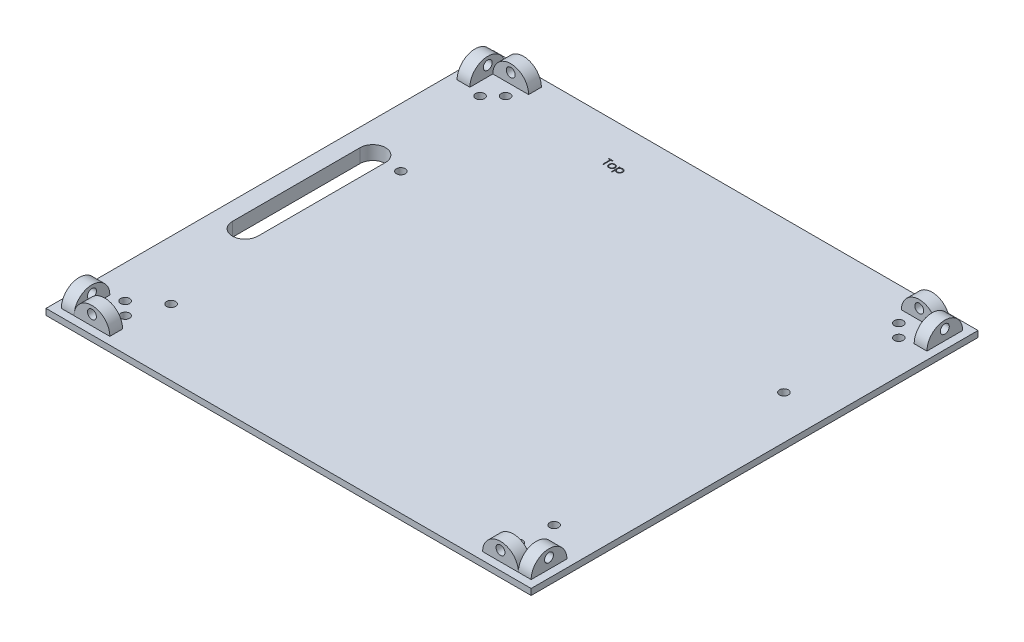
from build123d import *

# Parameters (mm, degrees)
SKETCH1_W                   = 190
SKETCH1_H                   = 175
SKETCH1_R                   = 1.75
BASE_DEPTH                  = 5.4
SKETCH3_R                   = 1.75
LONG_SIDE_CONNECTORS_DEPTH  = 5
SHORT_SIDE_CONNECTORS_DEPTH = 5
MIRROR3_COPY_1_DEPTH        = 5
CUT_EXTRUDE6_START          = -5.4
SKETCH11_R                  = 1.75
CUT_EXTRUDE6_DEPTH          = 179.761105811
CHAMFER2_SIZE               = 3
CUT_EXTRUDE7_DEPTH          = 1
CUT_EXTRUDE8_DEPTH          = 174.361105949


with BuildPart() as part:
    # Sketch1 → Base (new body)
    with BuildSketch(Plane(origin=(0, 0, 0), x_dir=(1, 0, 0), z_dir=(0, 1, 0))):
        with Locations((-51.064381671, 5.614281477)):
            Rectangle(SKETCH1_W, SKETCH1_H)
        with Locations(Location((-123.064381671, 34.114281477, 0), (0, 0, 270))):
            Circle(SKETCH1_R, mode=Mode.SUBTRACT)
        with Locations(Location((26.935618329, 34.114281477, 0), (0, 0, 270))):
            Circle(SKETCH1_R, mode=Mode.SUBTRACT)
        with Locations(Location((26.935618329, -55.885718523, 0), (0, 0, 270))):
            Circle(SKETCH1_R, mode=Mode.SUBTRACT)
        with Locations(Location((-123.064381671, -55.885718523, 0), (0, 0, 270))):
            Circle(SKETCH1_R, mode=Mode.SUBTRACT)
    extrude(amount=-BASE_DEPTH)

    # Sketch3 → Long_Side_connectors (add)
    # profile 1 of 2: a face of its own
    with BuildSketch(Plane(origin=(-143.064381671, 0, 0), x_dir=(0, 0, -1), z_dir=(1, 0, 0))):
        with BuildLine():
            Line((76.114281477, 0), (90.114281477, 0))
            ThreePointArc((90.114281477, 0), (83.114281477, 7), (76.114281477, 0))
        make_face()
        with Locations((83.114281477, 4)):
            Circle(SKETCH3_R, mode=Mode.SUBTRACT)
    # profile 2 of 2: a face of its own
    with BuildSketch(Plane(origin=(-143.064381671, 0, 0), x_dir=(0, 0, -1), z_dir=(1, 0, 0))):
        with BuildLine():
            Line((-78.885718523, 0), (-64.885718523, 0))
            ThreePointArc((-64.885718523, 0), (-71.885718523, 7), (-78.885718523, 0))
        make_face()
        with Locations((-71.885718523, 4)):
            Circle(SKETCH3_R, mode=Mode.SUBTRACT)
    long_side_connectors = extrude(amount=LONG_SIDE_CONNECTORS_DEPTH)

    # Sketch4 → Short_side_connectors (add)
    with BuildSketch(Plane.XY.offset(78.885718523)):
        with BuildLine():
            ThreePointArc((-131.064381671, 7), (-136.014129139, 4.949747468), (-138.064381671, 0))
            Line((-138.064381671, 0), (-131.064381671, 0))
            Line((-131.064381671, 0), (-131.064381671, 2.25))
            ThreePointArc((-131.064381671, 2.25), (-132.814381671, 4), (-131.064381671, 5.75))
            Line((-131.064381671, 5.75), (-131.064381671, 7))
        make_face()
        with BuildLine():
            Line((-131.064381671, 2.25), (-131.064381671, 0))
            Line((-131.064381671, 0), (-124.064381671, 0))
            ThreePointArc((-124.064381671, 0), (-126.114634203, 4.949747468), (-131.064381671, 7))
            Line((-131.064381671, 7), (-131.064381671, 5.75))
            ThreePointArc((-131.064381671, 5.75), (-129.826944804, 5.237436867), (-129.314381671, 4))
            ThreePointArc((-129.314381671, 4), (-129.826944804, 2.762563133), (-131.064381671, 2.25))
        make_face()
        with BuildLine():
            ThreePointArc((-131.064381671, 7), (-136.014129139, 4.949747468), (-138.064381671, 0))
            Line((-138.064381671, 0), (-131.064381671, 0))
            Line((-131.064381671, 0), (-131.064381671, 2.25))
            ThreePointArc((-131.064381671, 2.25), (-132.814381671, 4), (-131.064381671, 5.75))
            Line((-131.064381671, 5.75), (-131.064381671, 7))
        make_face()
        with BuildLine():
            Line((-131.064381671, 2.25), (-131.064381671, 0))
            Line((-131.064381671, 0), (-124.064381671, 0))
            ThreePointArc((-124.064381671, 0), (-126.114634203, 4.949747468), (-131.064381671, 7))
            Line((-131.064381671, 7), (-131.064381671, 5.75))
            ThreePointArc((-131.064381671, 5.75), (-129.826944804, 5.237436867), (-129.314381671, 4))
            ThreePointArc((-129.314381671, 4), (-129.826944804, 2.762563133), (-131.064381671, 2.25))
        make_face()
    short_side_connectors = extrude(amount=-SHORT_SIDE_CONNECTORS_DEPTH)

    # Mirror1: Short_side_connectors across plane
    add(short_side_connectors.mirror(Plane.XY.offset(-5.614281477)))

    # Mirror3: Long_Side_connectors, Short_side_connectors across plane
    add(long_side_connectors.mirror(Plane(origin=(-51.064381671, 0, 0), x_dir=(0, 0, 1), z_dir=(1, 0, 0))))
    add(short_side_connectors.mirror(Plane(origin=(-51.064381671, 0, 0), x_dir=(0, 0, 1), z_dir=(1, 0, 0))))

    # Mirror3 copy 1 sketch → Mirror3 copy 1 (add)
    with BuildSketch(Plane(origin=(-102.128763342, 0, -90.114281477), x_dir=(-1, 0, 0), z_dir=(0, 0, -1))):
        with BuildLine():
            ThreePointArc((-131.064381671, 7), (-136.014129139, 4.949747468), (-138.064381671, 0))
            Line((-138.064381671, 0), (-131.064381671, 0))
            Line((-131.064381671, 0), (-131.064381671, 2.25))
            ThreePointArc((-131.064381671, 2.25), (-132.814381671, 4), (-131.064381671, 5.75))
            Line((-131.064381671, 5.75), (-131.064381671, 7))
        make_face()
        with BuildLine():
            Line((-131.064381671, 2.25), (-131.064381671, 0))
            Line((-131.064381671, 0), (-124.064381671, 0))
            ThreePointArc((-124.064381671, 0), (-126.114634203, 4.949747468), (-131.064381671, 7))
            Line((-131.064381671, 7), (-131.064381671, 5.75))
            ThreePointArc((-131.064381671, 5.75), (-129.826944804, 5.237436867), (-129.314381671, 4))
            ThreePointArc((-129.314381671, 4), (-129.826944804, 2.762563133), (-131.064381671, 2.25))
        make_face()
        with BuildLine():
            ThreePointArc((-131.064381671, 7), (-136.014129139, 4.949747468), (-138.064381671, 0))
            Line((-138.064381671, 0), (-131.064381671, 0))
            Line((-131.064381671, 0), (-131.064381671, 2.25))
            ThreePointArc((-131.064381671, 2.25), (-132.814381671, 4), (-131.064381671, 5.75))
            Line((-131.064381671, 5.75), (-131.064381671, 7))
        make_face()
        with BuildLine():
            Line((-131.064381671, 2.25), (-131.064381671, 0))
            Line((-131.064381671, 0), (-124.064381671, 0))
            ThreePointArc((-124.064381671, 0), (-126.114634203, 4.949747468), (-131.064381671, 7))
            Line((-131.064381671, 7), (-131.064381671, 5.75))
            ThreePointArc((-131.064381671, 5.75), (-129.826944804, 5.237436867), (-129.314381671, 4))
            ThreePointArc((-129.314381671, 4), (-129.826944804, 2.762563133), (-131.064381671, 2.25))
        make_face()
    extrude(amount=-MIRROR3_COPY_1_DEPTH)

    # Sketch11 → Cut-Extrude6 (cut, through all)
    with BuildSketch(Plane(origin=(0, 0, 0), x_dir=(1, 0, 0), z_dir=(0, 1, 0)).offset(CUT_EXTRUDE6_START)):
        with Locations(Location((-133.064381671, -63.885718523, 0), (0, 0, 90))):
            Circle(SKETCH11_R)
        with Locations(Location((-128.064381671, -68.885718523, 0), (0, 0, 90))):
            Circle(SKETCH11_R)
        with Locations(Location((-133.064381671, 75.114281477, 0), (0, 0, 90))):
            Circle(SKETCH11_R)
        with Locations(Location((-128.064381671, 80.114281477, 0), (0, 0, 90))):
            Circle(SKETCH11_R)
        with Locations(Location((30.935618329, -63.885718523, 0), (0, 0, 90))):
            Circle(SKETCH11_R)
        with Locations(Location((25.935618329, -68.885718523, 0), (0, 0, 90))):
            Circle(SKETCH11_R)
        with Locations(Location((30.935618329, 75.114281477, 0), (0, 0, 90))):
            Circle(SKETCH11_R)
        with Locations(Location((25.935618329, 80.114281477, 0), (0, 0, 90))):
            Circle(SKETCH11_R)
    extrude(amount=CUT_EXTRUDE6_DEPTH, mode=Mode.SUBTRACT)

    # Chamfer2
    chamfer2_edges = [part.edges().sort_by_distance(p)[0] for p in [
        (43.935618329, -5.4, -5.614281477),
        (-51.064381671, -5.4, -93.114281477),
        (-146.064381671, -5.4, -5.614281477),
        (-51.064381671, -5.4, 81.885718523),
    ]]
    chamfer(chamfer2_edges, length=CHAMFER2_SIZE)

    # Sketch12 → Cut-Extrude7 (cut)
    # profile 1 of 3: a face of its own
    with BuildSketch(Plane(origin=(0, 0, 0), x_dir=(1, 0, 0), z_dir=(0, 1, 0))):
        Polygon((-86.672059971, 78.894376254), (-86.672059971, 79.22001728), (-85.003149714, 79.22001728), (-85.003149714, 78.894376254), (-85.695136894, 78.894376254), (-85.695136894, 76.04501728), (-85.980072791, 76.04501728), (-85.980072791, 78.894376254), align=None)
    # profile 2 of 3: a face of its own
    with BuildSketch(Plane(origin=(0, 0, 0), x_dir=(1, 0, 0), z_dir=(0, 1, 0))):
        with BuildLine():
            add(Edge.make_bspline(
                [(-83.475435371, 78.405914716), (-83.431900431, 78.404987715), (-83.346539052, 78.403170092), (-83.221527613, 78.383743659), (-83.102197382, 78.354037121), (-82.988091337, 78.312969347), (-82.88067084, 78.257922149), (-82.778371212, 78.192236577), (-82.681472925, 78.11441951), (-82.623394891, 78.054223263), (-82.593914939, 78.023668121)],
                knots=[0, 0, 0, 0, 1.054011418, 2.066658804, 3.057071809, 4.030435133, 4.997543892, 5.974964718, 6.972108034, 8, 8, 8, 8], degree=3))
            add(Edge.make_bspline(
                [(-82.593914939, 78.023668121), (-82.568531309, 77.994445434), (-82.518255292, 77.936565599), (-82.453788533, 77.842716579), (-82.398251832, 77.745525202), (-82.353744718, 77.643700841), (-82.318651875, 77.53813239), (-82.293736565, 77.428456994), (-82.278916631, 77.314916865), (-82.276918225, 77.23780624), (-82.275906124, 77.198753257)],
                knots=[0, 0, 0, 0, 1.025258237, 2.030674902, 3.01204498, 3.988269485, 4.97094183, 5.956517959, 6.965070386, 8, 8, 8, 8], degree=3))
            add(Edge.make_bspline(
                [(-82.275906124, 77.198753257), (-82.276796338, 77.159473919), (-82.27855544, 77.081856116), (-82.295195721, 76.967538548), (-82.321077492, 76.856690387), (-82.358117802, 76.749775715), (-82.405614087, 76.646467722), (-82.463572068, 76.547217631), (-82.532398463, 76.451829624), (-82.610416375, 76.361113671), (-82.696642005, 76.277505747), (-82.790183082, 76.204636531), (-82.889201385, 76.142205577), (-82.995013569, 76.091916829), (-83.106653361, 76.052265886), (-83.224361558, 76.024416586), (-83.347955301, 76.007578487), (-83.43234428, 76.005416245), (-83.475435371, 76.004312152)],
                knots=[0, 0, 0, 0, 0.998656419, 1.973391657, 2.932242238, 3.890759089, 4.846373663, 5.82037756, 6.809684879, 7.83454468, 8.860553229, 9.859544525, 10.845671541, 11.83227036, 12.833544569, 13.85385346, 14.904124723, 16, 16, 16, 16], degree=3))
            add(Edge.make_bspline(
                [(-83.475435371, 76.004312152), (-83.518737581, 76.005419951), (-83.603547147, 76.007589632), (-83.727577145, 76.024351167), (-83.845496299, 76.052253051), (-83.957282242, 76.092047134), (-84.063549353, 76.142207185), (-84.16314139, 76.204447789), (-84.256758456, 76.277527358), (-84.343002327, 76.361107815), (-84.421015348, 76.451831133), (-84.489843005, 76.547217239), (-84.547800658, 76.646467824), (-84.595297029, 76.749775688), (-84.632337317, 76.856690395), (-84.658219094, 76.967538546), (-84.674859372, 77.081856116), (-84.676618475, 77.15947392), (-84.677508689, 77.198753257)],
                knots=[0, 0, 0, 0, 1.099876186, 2.154163076, 3.173186993, 4.173200201, 5.163417411, 6.152872554, 7.150605724, 8.17532212, 9.198891216, 10.186952605, 11.159729845, 12.11414092, 13.071450619, 14.029093627, 15.002601286, 16, 16, 16, 16], degree=3))
            add(Edge.make_bspline(
                [(-84.677508689, 77.198753257), (-84.676489686, 77.237593981), (-84.674472235, 77.314491939), (-84.659667202, 77.42781863), (-84.634849083, 77.537308404), (-84.599714173, 77.642469372), (-84.554796821, 77.743847517), (-84.50004051, 77.841279043), (-84.43491615, 77.93470369), (-84.384840094, 77.99250872), (-84.359499874, 78.021760068)],
                knots=[0, 0, 0, 0, 1.031353054, 2.041901799, 3.029428768, 4.008703097, 4.981709435, 5.96992636, 6.972712378, 8, 8, 8, 8], degree=3))
            add(Edge.make_bspline(
                [(-84.359499874, 78.021760068), (-84.330064367, 78.052580192), (-84.272174262, 78.113193388), (-84.17479363, 78.190783606), (-84.072745664, 78.257836044), (-83.964138052, 78.311789468), (-83.850125746, 78.354278695), (-83.730184004, 78.38382027), (-83.604748358, 78.403100099), (-83.518969273, 78.40496716), (-83.475435371, 78.405914716)],
                knots=[0, 0, 0, 0, 1.027980169, 2.021703884, 2.998553061, 3.971491411, 4.943284454, 5.930300938, 6.949603206, 8, 8, 8, 8], degree=3))
        make_face()
        with BuildLine():
            add(Edge.make_bspline(
                [(-83.476707407, 78.120978818), (-83.507493668, 78.120103796), (-83.568271449, 78.11837634), (-83.657733501, 78.105237369), (-83.743857784, 78.084420704), (-83.826807692, 78.054844168), (-83.906303499, 78.016654452), (-83.982421314, 77.969747583), (-84.055385027, 77.914744829), (-84.123767327, 77.851732263), (-84.186525568, 77.782899175), (-84.241387732, 77.709558164), (-84.28803765, 77.632898835), (-84.326899794, 77.552841472), (-84.355844172, 77.468574783), (-84.376865414, 77.381053067), (-84.389991989, 77.290098011), (-84.391703204, 77.22826623), (-84.392572791, 77.196845205)],
                knots=[0, 0, 0, 0, 1.021534396, 2.016698045, 2.994645724, 3.958388632, 4.93408049, 5.916473867, 6.921342795, 7.962252576, 8.998418191, 10.008913653, 10.997312074, 11.973003931, 12.956656626, 13.948281152, 14.957379055, 16, 16, 16, 16], degree=3))
            add(Edge.make_bspline(
                [(-84.392572791, 77.196845205), (-84.391115173, 77.156248723), (-84.388222072, 77.075672298), (-84.364695108, 76.957007922), (-84.325337554, 76.843087242), (-84.272190522, 76.734578092), (-84.205600595, 76.634182525), (-84.12714447, 76.544673393), (-84.03766417, 76.467397693), (-83.938226345, 76.403280069), (-83.830862071, 76.352335147), (-83.717236694, 76.316231791), (-83.598726921, 76.29276247), (-83.517736544, 76.290429775), (-83.476707407, 76.289248049)],
                knots=[0, 0, 0, 0, 1.016792936, 2.018143844, 3.017858371, 4.030088057, 5.03801393, 6.028138512, 7.003788237, 7.991172063, 8.984598303, 9.972568034, 10.972917682, 12, 12, 12, 12], degree=3))
            add(Edge.make_bspline(
                [(-83.476707407, 76.289248049), (-83.435680629, 76.290436661), (-83.35469491, 76.292782946), (-83.236349799, 76.31611359), (-83.123034982, 76.352493339), (-83.015782223, 76.403222773), (-82.916389662, 76.467641177), (-82.826265816, 76.544237034), (-82.748479576, 76.634419599), (-82.68195552, 76.734711071), (-82.627938118, 76.842919019), (-82.588764785, 76.957028948), (-82.56518126, 77.075666943), (-82.562295794, 77.156246929), (-82.560842022, 77.196845205)],
                knots=[0, 0, 0, 0, 1.02726834, 2.027799167, 3.010890988, 4.004497153, 4.992059811, 5.971914811, 6.958719428, 7.966827853, 8.981595046, 9.981490638, 10.983022906, 12, 12, 12, 12], degree=3))
            add(Edge.make_bspline(
                [(-82.560842022, 77.196845205), (-82.56171131, 77.228266418), (-82.563421935, 77.290098568), (-82.576552796, 77.381050937), (-82.597558178, 77.468582599), (-82.626561003, 77.552812631), (-82.665254287, 77.633106117), (-82.712803806, 77.709333084), (-82.767441951, 77.783153236), (-82.830957482, 77.851509753), (-82.899268403, 77.914769393), (-82.972261688, 77.969768911), (-83.048266632, 78.016448301), (-83.12753149, 78.055170819), (-83.210492033, 78.084151621), (-83.296495643, 78.105357565), (-83.385575992, 78.118320815), (-83.446135981, 78.120087151), (-83.476707407, 78.120978818)],
                knots=[0, 0, 0, 0, 1.042956736, 2.052379634, 3.044323526, 4.02829302, 5.004299113, 5.996692471, 7.007513377, 8.048758398, 9.090003419, 10.095195979, 11.07790575, 12.047570684, 13.018257071, 13.989683339, 14.985167495, 16, 16, 16, 16], degree=3))
        make_face(mode=Mode.SUBTRACT)
    # profile 3 of 3: a face of its own
    with BuildSketch(Plane(origin=(0, 0, 0), x_dir=(1, 0, 0), z_dir=(0, 1, 0))):
        with BuildLine():
            Line((-81.70603433, 78.365209588), (-81.421098432, 78.365209588))
            Line((-81.421098432, 78.365209588), (-81.421098432, 77.935897689))
            add(Edge.make_bspline(
                [(-81.421098432, 77.935897689), (-81.390838429, 77.974848347), (-81.332034168, 78.050541157), (-81.230683718, 78.148503631), (-81.123707256, 78.231121942), (-81.008351875, 78.295876097), (-80.886410385, 78.344699262), (-80.758383211, 78.380784906), (-80.62318376, 78.402049672), (-80.530749121, 78.404609322), (-80.483608448, 78.405914716)],
                knots=[0, 0, 0, 0, 1.0828784, 2.104357462, 3.088488658, 4.04616522, 5.001424249, 5.969181776, 6.964304535, 8, 8, 8, 8], degree=3))
            add(Edge.make_bspline(
                [(-80.483608448, 78.405914716), (-80.44243178, 78.404723475), (-80.361043931, 78.402368925), (-80.241243716, 78.386427654), (-80.125877475, 78.359106604), (-80.015597884, 78.319735774), (-79.909223532, 78.271062598), (-79.808329198, 78.209633573), (-79.71134333, 78.138507957), (-79.620705073, 78.056654505), (-79.536956403, 77.968091721), (-79.464524511, 77.872821488), (-79.402047854, 77.773976856), (-79.351546943, 77.670025458), (-79.311987942, 77.561785871), (-79.283853199, 77.448820785), (-79.267109479, 77.331549039), (-79.264862984, 77.251808714), (-79.263726637, 77.21147361)],
                knots=[0, 0, 0, 0, 1.041296284, 2.058176809, 3.050446431, 4.034000596, 5.01514041, 6.003636468, 7.015969324, 8.052561599, 9.08815499, 10.094063707, 11.074456064, 12.040834395, 13.011057502, 13.983766392, 14.980127149, 16, 16, 16, 16], degree=3))
            add(Edge.make_bspline(
                [(-79.263726637, 77.21147361), (-79.264838328, 77.17028723), (-79.267030742, 77.089061745), (-79.28403514, 76.969784164), (-79.311210304, 76.855042047), (-79.350270228, 76.745026243), (-79.400745006, 76.639812502), (-79.462162715, 76.5394767), (-79.534631153, 76.444050984), (-79.617454319, 76.354830853), (-79.707309482, 76.272644333), (-79.80335549, 76.200764085), (-79.904101801, 76.140401551), (-80.009032982, 76.089979867), (-80.119047311, 76.051977671), (-80.233631498, 76.024565809), (-80.35272316, 76.007661659), (-80.433732062, 76.005437216), (-80.474704201, 76.004312152)],
                knots=[0, 0, 0, 0, 1.038740735, 2.04854663, 3.033179607, 4.009277356, 4.987731542, 5.972001279, 6.972200261, 8.005528982, 9.039189865, 10.040446548, 11.026516639, 11.997840187, 12.972163198, 13.956796175, 14.96660207, 16, 16, 16, 16], degree=3))
            add(Edge.make_bspline(
                [(-80.474704201, 76.004312152), (-80.52081207, 76.005486727), (-80.611888629, 76.007806858), (-80.745055087, 76.031319466), (-80.873213374, 76.066459401), (-80.994943622, 76.117893488), (-81.111210138, 76.183439563), (-81.221355248, 76.263368107), (-81.325964016, 76.357511959), (-81.388927675, 76.428932964), (-81.421098432, 76.465424932)],
                knots=[0, 0, 0, 0, 1.014726462, 2.004382257, 2.969841629, 3.936926163, 4.907207904, 5.903978561, 6.929055279, 8, 8, 8, 8], degree=3))
            Line((-81.421098432, 76.465424932), (-81.421098432, 75.190209588))
            Line((-81.421098432, 75.190209588), (-81.70603433, 75.190209588))
            Line((-81.70603433, 75.190209588), (-81.70603433, 78.365209588))
        make_face()
        with BuildLine():
            add(Edge.make_bspline(
                [(-80.486152519, 78.120978818), (-80.518428265, 78.120398013), (-80.581970889, 78.119254556), (-80.675109259, 78.105671045), (-80.76482154, 78.085951809), (-80.850203596, 78.056096013), (-80.932073798, 78.019448519), (-81.009801576, 77.973654123), (-81.08333237, 77.919541232), (-81.152481176, 77.858146398), (-81.214950021, 77.790496503), (-81.270252105, 77.71829899), (-81.316704446, 77.641645292), (-81.35525985, 77.561249428), (-81.384599828, 77.476481205), (-81.405423946, 77.3878234), (-81.418514337, 77.295178975), (-81.420227873, 77.232081741), (-81.421098432, 77.200025293)],
                knots=[0, 0, 0, 0, 1.05670511, 2.080379991, 3.077984906, 4.06214886, 5.038337365, 6.01289324, 7.01187578, 8.025460281, 9.038092164, 10.024533457, 11.000252242, 11.969694649, 12.940728589, 13.933144304, 14.949937299, 16, 16, 16, 16], degree=3))
            add(Edge.make_bspline(
                [(-81.421098432, 77.200025293), (-81.419655298, 77.157944648), (-81.416828077, 77.0755051), (-81.393843465, 76.955050933), (-81.35643719, 76.841066931), (-81.303343285, 76.73451299), (-81.236262271, 76.636557133), (-81.155437515, 76.54884494), (-81.061600344, 76.471927761), (-80.95631082, 76.40713848), (-80.843442173, 76.35453502), (-80.72570781, 76.316875701), (-80.604726811, 76.293678036), (-80.522931263, 76.290732708), (-80.481700395, 76.289248049)],
                knots=[0, 0, 0, 0, 1.03728447, 2.032128127, 3.01272805, 3.987917167, 4.958271349, 5.931593992, 6.91984656, 7.941419022, 8.973179163, 9.983609215, 10.983593296, 12, 12, 12, 12], degree=3))
            add(Edge.make_bspline(
                [(-80.481700395, 76.289248049), (-80.441300092, 76.290659905), (-80.361112751, 76.293462186), (-80.243040741, 76.317717542), (-80.128295662, 76.354769814), (-80.019275077, 76.40879884), (-79.916928056, 76.47501125), (-79.824506932, 76.554440709), (-79.743764947, 76.646506586), (-79.674945139, 76.749021442), (-79.619490149, 76.858944826), (-79.57782486, 76.972683657), (-79.553777797, 77.089837005), (-79.550369853, 77.168756359), (-79.548662535, 77.208293522)],
                knots=[0, 0, 0, 0, 1.00104056, 1.986885549, 2.97790532, 3.984399681, 4.995088187, 5.994304198, 6.996462723, 8.023150851, 9.048424203, 10.043036403, 11.019596776, 12, 12, 12, 12], degree=3))
            add(Edge.make_bspline(
                [(-79.548662535, 77.208293522), (-79.549982186, 77.248076262), (-79.552611208, 77.327331795), (-79.578507449, 77.444138142), (-79.617423857, 77.558336521), (-79.674173854, 77.666758734), (-79.741485006, 77.769060937), (-79.822898353, 77.859370527), (-79.914171617, 77.938446781), (-80.016396787, 78.003775045), (-80.12610703, 78.055741173), (-80.241599847, 78.093735617), (-80.362289401, 78.116571804), (-80.44450163, 78.119496891), (-80.486152519, 78.120978818)],
                knots=[0, 0, 0, 0, 0.983928682, 1.960191568, 2.949917689, 3.96440592, 4.982380491, 5.975291189, 6.965713506, 7.964880129, 8.970154049, 9.96478489, 10.968906225, 12, 12, 12, 12], degree=3))
        make_face(mode=Mode.SUBTRACT)
    extrude(amount=-CUT_EXTRUDE7_DEPTH, mode=Mode.SUBTRACT)

    # Sketch13 → Cut-Extrude8 (cut, through all)
    with BuildSketch(Plane(origin=(0, 0, 0), x_dir=(1, 0, 0), z_dir=(0, 1, 0))):
        with BuildLine():
            Line((-129.064381671, 34.114281477), (-129.064381671, -15.885718523))
            ThreePointArc((-129.064381671, -15.885718523), (-134.064381671, -20.885718523), (-139.064381671, -15.885718523))
            Line((-139.064381671, -15.885718523), (-139.064381671, 34.114281477))
            ThreePointArc((-139.064381671, 34.114281477), (-134.064381671, 39.114281477), (-129.064381671, 34.114281477))
        make_face()
    extrude(amount=-CUT_EXTRUDE8_DEPTH, mode=Mode.SUBTRACT)


solid = part.part
